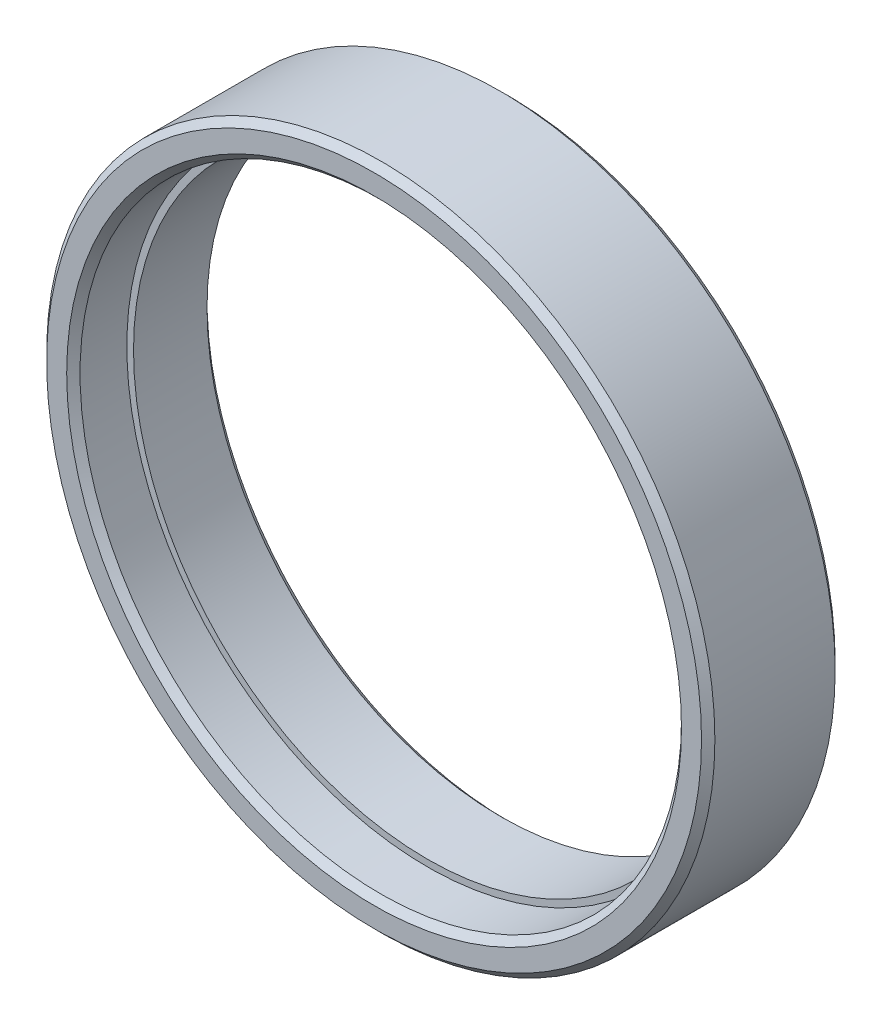
from build123d import *

# Parameters (mm, degrees)
SKETCH_1_R          = 50
EXTRUDE_1_DEPTH     = 20
SKETCH_2_R          = 45
CUT_EXTRUDE_1_DEPTH = 8
SKETCH_3_R          = 44
CUT_EXTRUDE_2_DEPTH = 12
CHAMFER_1_SIZE      = 1


with BuildPart() as part:
    # 스케치1 → 보스-돌출1 (new body)
    with BuildSketch(Plane.XY):
        Circle(SKETCH_1_R)
    extrude(amount=EXTRUDE_1_DEPTH)

    # 스케치2 → 컷-돌출1 (cut)
    with BuildSketch(Plane.XY.offset(20)):
        Circle(SKETCH_2_R)
    extrude(amount=-CUT_EXTRUDE_1_DEPTH, mode=Mode.SUBTRACT)

    # 스케치3 → 컷-돌출2 (cut)
    with BuildSketch(Plane(origin=(0, 0, 0), x_dir=(-1, 0, 0), z_dir=(0, 0, -1))):
        Circle(SKETCH_3_R)
    extrude(amount=-CUT_EXTRUDE_2_DEPTH, mode=Mode.SUBTRACT)

    # 모따기1
    chamfer_1_edges = [part.edges().sort_by_distance(p)[0] for p in [
        (44, 0, 0),
        (-50, 0, 0),
        (-50, 0, 20),
        (-45, 0, 20),
    ]]
    chamfer(chamfer_1_edges, length=CHAMFER_1_SIZE)


solid = part.part
